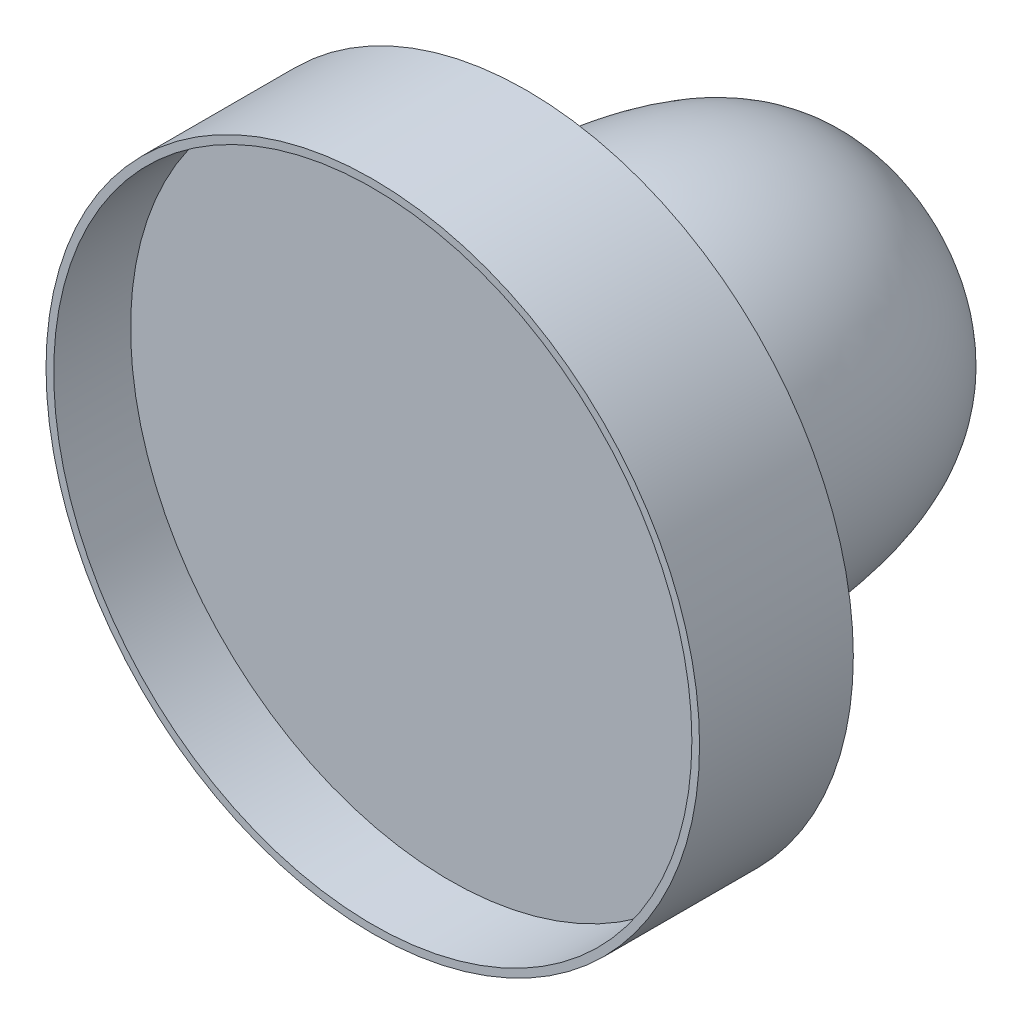
from build123d import *

# Parameters (mm, degrees)
SKETCH2_R          = 4.15
CUT_EXTRUDE1_DEPTH = 1


with BuildPart() as part:
    # Sketch1 → Revolve2 (revolve)
    with BuildSketch(Plane(origin=(0, 0, 0), x_dir=(1, 0, 0), z_dir=(0, 1, 0)), mode=Mode.PRIVATE) as revolve2_sk:
        with BuildLine():
            Line((0, 6.5), (0, 2))
            Line((0, 2), (0, 0))
            Line((0, 0), (4.25, 0))
            Line((4.25, 0), (4.25, 2))
            Line((4.25, 2), (2.569885929, 2))
            add(Edge.make_bspline(
                [(0, 6.5), (2.680858579, 6.941262723), (2.575253376, 4.026713707), (2.569885929, 2)],
                knots=[0, 0, 0, 0, 0.962492363, 0.962492363, 0.962492363, 0.962492363], degree=3))
        make_face()
    revolve(revolve2_sk.sketch.rotate(Axis((0, 0, -6.5), (0, 0, 1)), 180), axis=Axis((0, 0, -6.5), (0, 0, 1)))

    # Sketch2 → Cut-Extrude1 (cut)
    with BuildSketch(Plane.XY):
        Circle(SKETCH2_R)
    extrude(amount=-CUT_EXTRUDE1_DEPTH, mode=Mode.SUBTRACT)


solid = part.part
